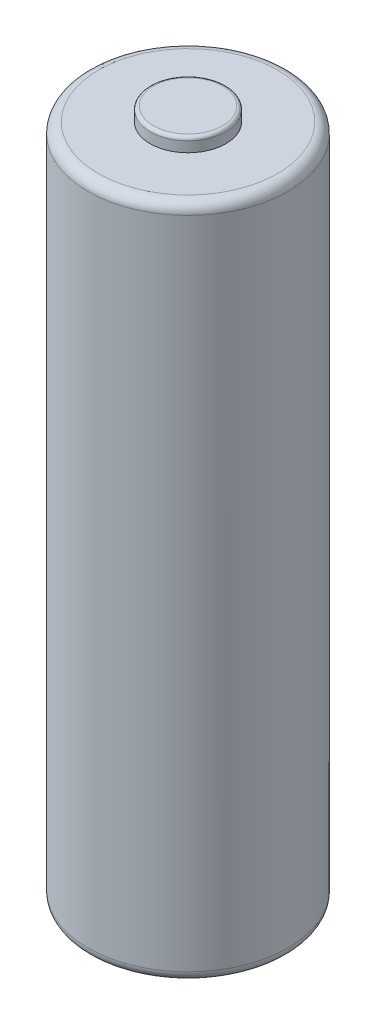
from build123d import *

# Parameters (mm, degrees)
SKETCH2_W = 2.75
SKETCH2_H = 1
FILLET1_R = 0.75
FILLET2_R = 0.25


with BuildPart() as part:
    # Sketch1 → Revolve1 (revolve)
    with BuildSketch(Plane.XY, mode=Mode.PRIVATE) as revolve1_sk:
        Polygon((0, 0), (-7.25, 0), (-7.25, -49), (-6.33564091, -49), (-3.5, -49.5), (0, -49.5), align=None)
    revolve(revolve1_sk.sketch.rotate(Axis((0, 0, 0), (0, -1, 0)), 270), axis=Axis((0, 0, 0), (0, -1, 0)))

    # Sketch2 → Revolve2 (revolve)
    with BuildSketch(Plane.XY, mode=Mode.PRIVATE) as revolve2_sk:
        with Locations((-1.375, 0.5)):
            Rectangle(SKETCH2_W, SKETCH2_H)
    revolve(revolve2_sk.sketch.rotate(Axis((0, 0, 0), (0, 1, 0)), 270), axis=Axis((0, 0, 0), (0, 1, 0)))

    # Fillet1
    fillet1_edges = [part.edges().sort_by_distance(p)[0] for p in [
        (0, -49, -7.25),
        (0, 0, -7.25),
    ]]
    fillet(fillet1_edges, radius=FILLET1_R)

    # Fillet2
    fillet2_edges = [part.edges().sort_by_distance(p)[0] for p in [
        (0, 1, 2.75),
    ]]
    fillet(fillet2_edges, radius=FILLET2_R)


solid = part.part
